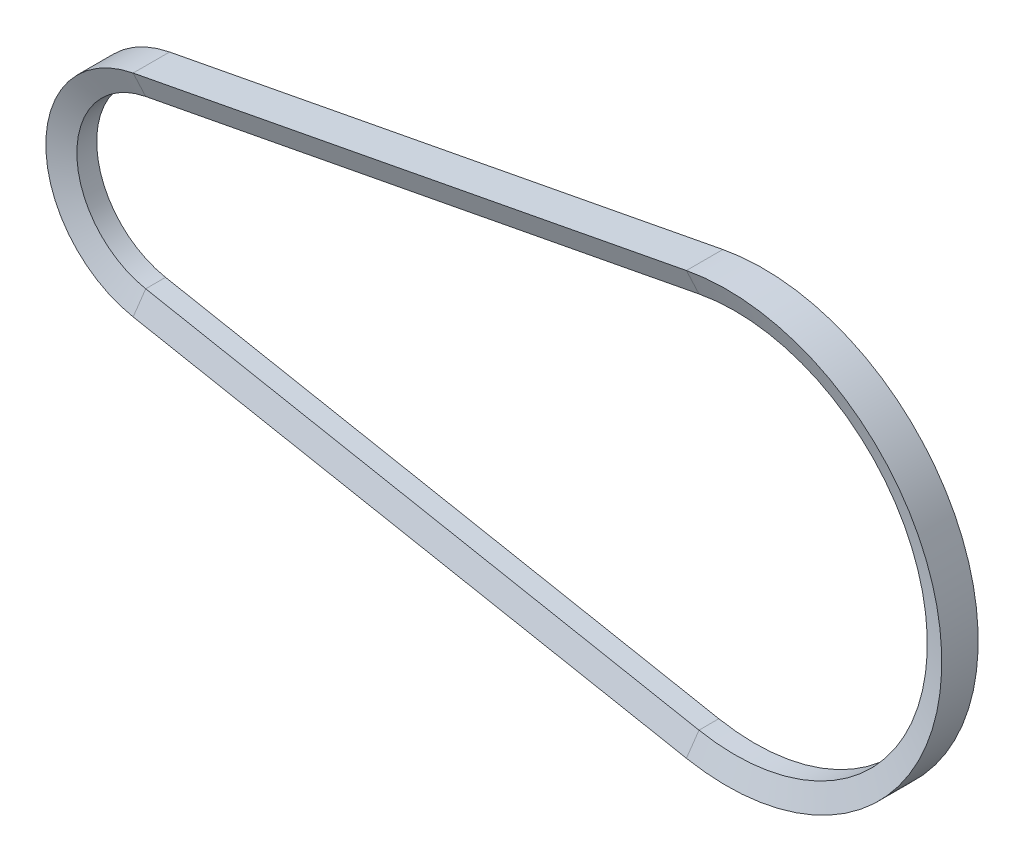
from build123d import *


with BuildPart() as part:
    # Sweep1: sweep along a path in Sketch1
    with BuildLine(Plane.XY) as sweep1_path:
        Line((-7.03125, 36.834922607), (185.9375, 73.669845213))
        ThreePointArc((185.9375, 73.669845213), (275, 0), (185.9375, -73.669845213))
        Line((185.9375, -73.669845213), (-7.03125, -36.834922607))
        ThreePointArc((-7.03125, -36.834922607), (-37.5, 0), (-7.03125, 36.834922607))
    # Sketch2 → Sweep1 (sweep)
    with BuildSketch(Plane(origin=(-7.03125, 36.834922607, 0), x_dir=(0, 0, -1), z_dir=(0.982264602843857, 0.1875000000000001, 0))):
        Polygon((6.35, 0), (-6.35, 0), (-3.460986266, -7.9375), (3.460986266, -7.9375), align=None)
    sweep(path=sweep1_path.line)


solid = part.part
